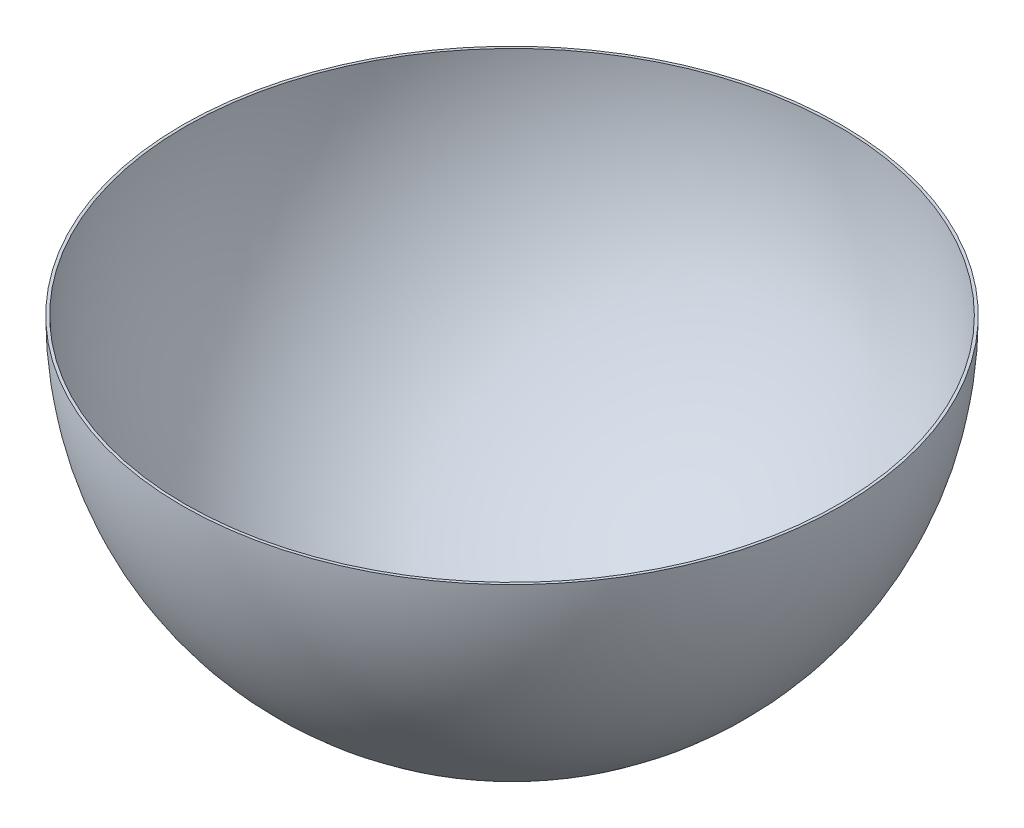
from build123d import *

# Parameters (mm, degrees)
REVOLVE1_ANGLE     = 180
SKETCH2_R          = 6.35
CUT_EXTRUDE1_DEPTH = 396.94681461


with BuildPart() as part:
    # Sketch1 → Revolve1 (revolve)
    with BuildSketch(Plane(origin=(0, 0, 0), x_dir=(1, 0, 0), z_dir=(0, 1, 0))):
        with BuildLine():
            ThreePointArc((0, 228.6), (228.6, 0), (0, -228.6))
            Line((0, -228.6), (0, -226.695))
            ThreePointArc((0, -226.695), (226.695, 0), (0, 226.695))
            Line((0, 226.695), (0, 228.6))
        make_face()
    revolve(axis=Axis((0, 0, 226.695), (0, 0, -1)), revolution_arc=REVOLVE1_ANGLE)

    # Sketch2 → Cut-Extrude1 (cut, through all)
    with BuildSketch(Plane(origin=(0, -228.6, 0), x_dir=(-1, 0, 0), z_dir=(0, -1, 0))):
        Circle(SKETCH2_R)
    extrude(amount=-CUT_EXTRUDE1_DEPTH, mode=Mode.SUBTRACT)


solid = part.part
